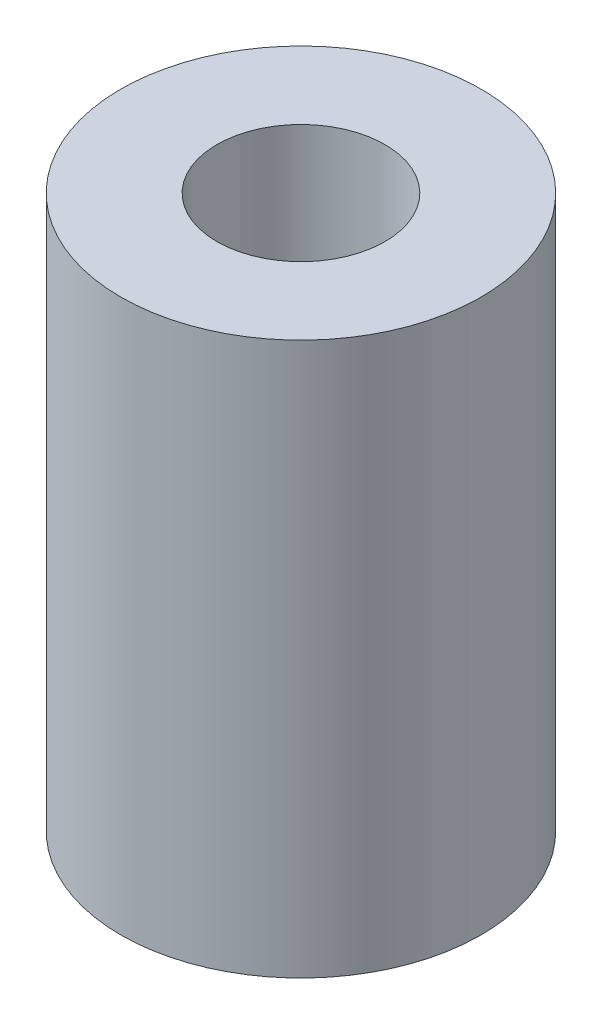
from build123d import *

# Parameters (mm, degrees)
SKETCH2_R           = 15
SKETCH2_R_2         = 7
BOSS_EXTRUDE2_DEPTH = 46


with BuildPart() as part:
    # Sketch2 → Boss-Extrude2 (new body)
    with BuildSketch(Plane(origin=(0, 0, 0), x_dir=(1, 0, 0), z_dir=(0, 1, 0))):
        with Locations(Location((0, 0, 0), (0, 0, 270))):
            Circle(SKETCH2_R)
        with Locations(Location((0, 0, 0), (0, 0, 270))):
            Circle(SKETCH2_R_2, mode=Mode.SUBTRACT)
    extrude(amount=BOSS_EXTRUDE2_DEPTH)


solid = part.part
